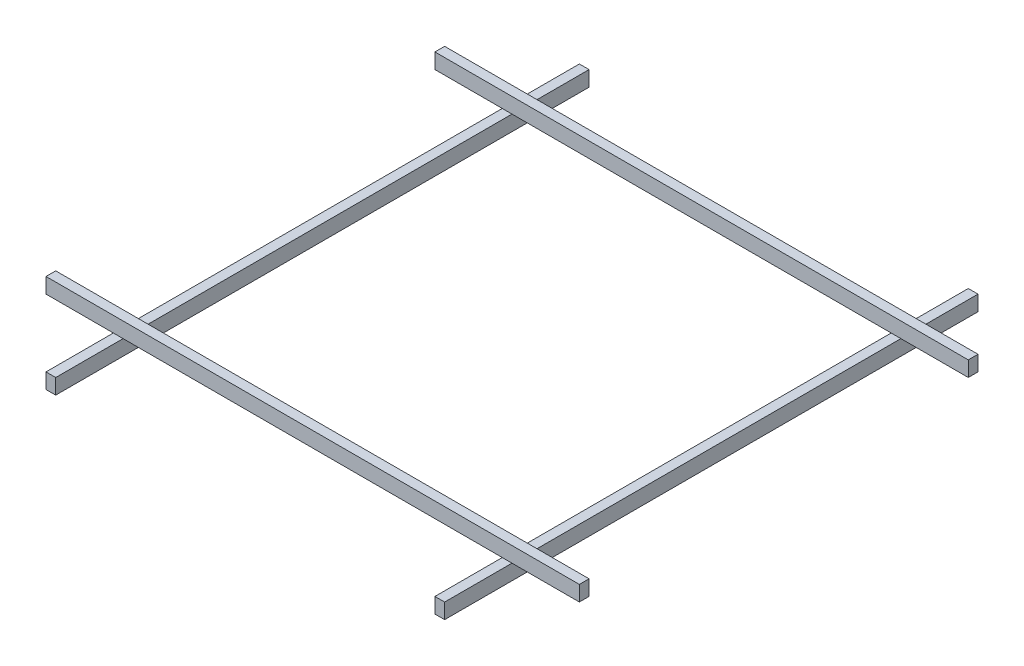
from build123d import *

# Parameters (mm, degrees)
SKETCH1_W              = 88.9
SKETCH1_H              = 139.7
PROFILES_4X6_1_DEPTH   = 4876.8
SKETCH1_ON_SEGMENT_2_W = 88.9
SKETCH1_ON_SEGMENT_2_H = 139.7
PROFILES_4X6_1_2_DEPTH = 4876.8
SKETCH1_ON_SEGMENT_3_W = 88.9
SKETCH1_ON_SEGMENT_3_H = 139.7
PROFILES_4X6_1_3_DEPTH = 4876.8
SKETCH1_ON_SEGMENT_4_W = 88.9
SKETCH1_ON_SEGMENT_4_H = 139.7
PROFILES_4X6_1_4_DEPTH = 4876.8


with BuildPart() as part:
    # Sketch1 → Profiles 4X6(1) (new body)
    with BuildSketch(Plane(origin=(355.6, 0, 0), x_dir=(-1, 0, 0), z_dir=(0, 0, -1))):
        Rectangle(SKETCH1_W, SKETCH1_H)
    extrude(amount=PROFILES_4X6_1_DEPTH)


with BuildPart() as body_2:
    # Sketch1 on segment 2 (carried to segment 2) → Profiles 4X6_1 2 (new body)
    with BuildSketch(Plane(origin=(3911.6, 0, 0), x_dir=(-1, 0, 0), z_dir=(0, 0, -1))):
        Rectangle(SKETCH1_ON_SEGMENT_2_W, SKETCH1_ON_SEGMENT_2_H)
    extrude(amount=PROFILES_4X6_1_2_DEPTH)


with BuildPart() as body_3:
    # Sketch1 on segment 3 (carried to segment 3) → Profiles 4X6_1 3 (new body)
    with BuildSketch(Plane(origin=(-304.8, 139.7, -4216.4), x_dir=(0, 0, -1), z_dir=(1, 0, 0))):
        Rectangle(SKETCH1_ON_SEGMENT_3_W, SKETCH1_ON_SEGMENT_3_H)
    extrude(amount=PROFILES_4X6_1_3_DEPTH)


with BuildPart() as body_4:
    # Sketch1 on segment 4 (carried to segment 4) → Profiles 4X6_1 4 (new body)
    with BuildSketch(Plane(origin=(4572, 139.7, -660.4), x_dir=(0, 0, 1), z_dir=(-1, 0, 0))):
        Rectangle(SKETCH1_ON_SEGMENT_4_W, SKETCH1_ON_SEGMENT_4_H)
    extrude(amount=PROFILES_4X6_1_4_DEPTH)


solid = Compound([part.part, body_2.part, body_3.part, body_4.part])
